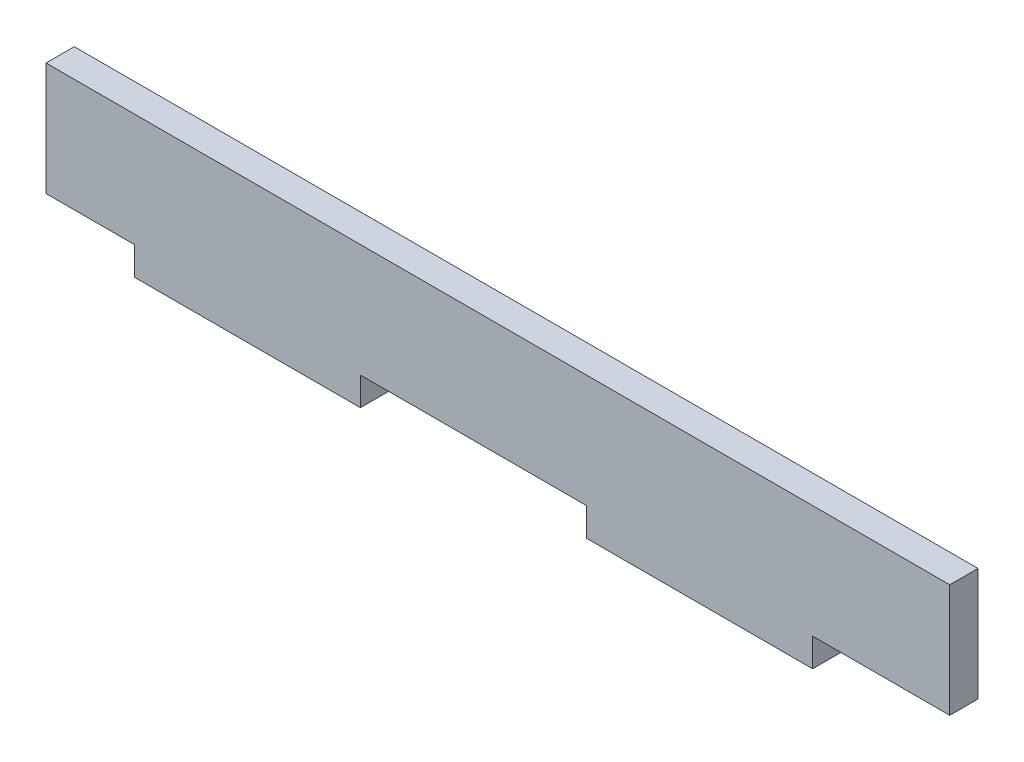
from build123d import *

# Parameters (mm, degrees)
SKETCH1_W           = 203.029806175
SKETCH1_H           = 31.75
BOSS_EXTRUDE1_DEPTH = 6.35
CUT_EXTRUDE1_REACH  = 241.441
SKETCH2_W           = 19.829806175
SKETCH2_H           = 6.35
SKETCH2_W_2         = 50.8
SKETCH2_W_3         = 30.8


with BuildPart() as part:
    # Sketch1 → Boss-Extrude1 (new body)
    with BuildSketch(Plane.XY):
        with Locations((132.485096913, 34.478439237)):
            Rectangle(SKETCH1_W, SKETCH1_H)
    extrude(amount=BOSS_EXTRUDE1_DEPTH)

    # Sketch2 → Cut-Extrude1 (cut, up to next)
    with BuildSketch(Plane.XY.offset(6.35), mode=Mode.PRIVATE) as cut_extrude1_sk1:
        with Locations((40.885096913, 21.778439237)):
            Rectangle(SKETCH2_W, SKETCH2_H)
    cut_extrude1_tool1 = extrude(cut_extrude1_sk1.sketch, amount=-CUT_EXTRUDE1_REACH, mode=Mode.PRIVATE) & part.part
    # Sketch2 → Cut-Extrude1 (cut, up to next)
    with BuildSketch(Plane.XY.offset(6.35), mode=Mode.PRIVATE) as cut_extrude1_sk2:
        with Locations((127, 21.778439237)):
            Rectangle(SKETCH2_W_2, SKETCH2_H)
    cut_extrude1_tool2 = extrude(cut_extrude1_sk2.sketch, amount=-CUT_EXTRUDE1_REACH, mode=Mode.PRIVATE) & part.part
    # Sketch2 → Cut-Extrude1 (cut, up to next)
    with BuildSketch(Plane.XY.offset(6.35), mode=Mode.PRIVATE) as cut_extrude1_sk3:
        with Locations((218.6, 21.778439237)):
            Rectangle(SKETCH2_W_3, SKETCH2_H)
    cut_extrude1_tool3 = extrude(cut_extrude1_sk3.sketch, amount=-CUT_EXTRUDE1_REACH, mode=Mode.PRIVATE) & part.part
    add(cut_extrude1_tool1.solids().sort_by_distance((40.885097, 21.778439, 6.35))[0], mode=Mode.SUBTRACT)
    add(cut_extrude1_tool2.solids().sort_by_distance((127, 21.778439, 6.35))[0], mode=Mode.SUBTRACT)
    add(cut_extrude1_tool3.solids().sort_by_distance((218.6, 21.778439, 6.35))[0], mode=Mode.SUBTRACT)


solid = part.part
